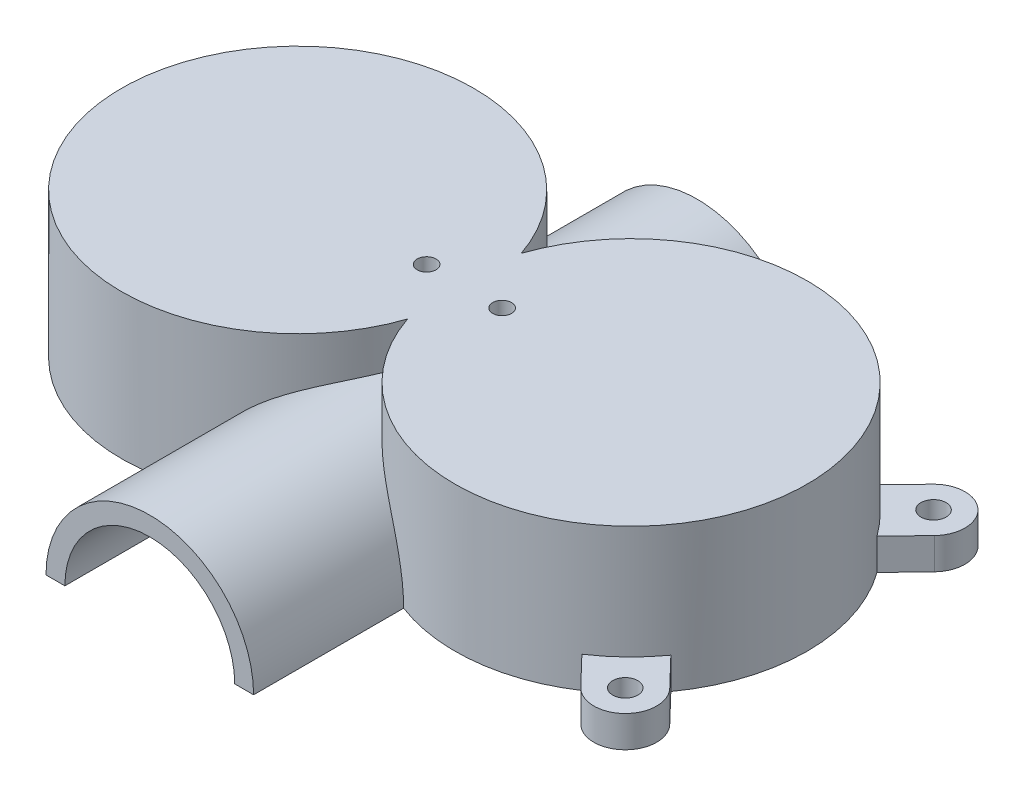
from build123d import *

# Parameters (mm, degrees)
BOSS_EXTRUDE1_DEPTH     = 23
SKETCH2_R               = 2
BOSS_EXTRUDE2_DEPTH     = 5
SKETCH3_R               = 2
BOSS_EXTRUDE3_DEPTH     = 5
BOSS_EXTRUDE4_DEPTH     = 37
BOSS_EXTRUDE5_START     = 50
BOSS_EXTRUDE5_DEPTH     = 50
CUT_EXTRUDE1_DEPTH      = 78.86002886
CUT_EXTRUDE1_DEPTH_BACK = 78.86002886
SKETCH5_R               = 25
CUT_EXTRUDE4_DEPTH      = 20
SKETCH7_R               = 1.5
CUT_EXTRUDE6_DEPTH      = 78.86002886


with BuildPart() as part:
    # Sketch1 → Boss-Extrude1 (new body)
    with BuildSketch(Plane(origin=(0, 0, 0), x_dir=(1, 0, 0), z_dir=(0, 1, 0))):
        with BuildLine():
            ThreePointArc((0, 9.04157066), (-54.5, 0), (0, -9.04157066))
            ThreePointArc((0, -9.04157066), (54.5, 0), (0, 9.04157066))
        make_face()
    extrude(amount=BOSS_EXTRUDE1_DEPTH)

    # Sketch2 → Boss-Extrude2 (add)
    with BuildSketch(Plane(origin=(0, 0, 0), x_dir=(1, 0, 0), z_dir=(0, 1, 0))):
        with BuildLine():
            Line((-33.5, 33), (-33.5, 27.110883423))
            ThreePointArc((-33.5, 27.110883423), (-28.532848636, 27.926108329), (-23.5, 27.838821814))
            Line((-23.5, 27.838821814), (-23.5, 33))
            ThreePointArc((-23.5, 33), (-28.5, 38), (-33.5, 33))
        make_face()
        with Locations((-28.5, 33)):
            Circle(SKETCH2_R, mode=Mode.SUBTRACT)
    extrude(amount=BOSS_EXTRUDE2_DEPTH)

    # Sketch3 → Boss-Extrude3 (add)
    # profile 1 of 2: a face of its own
    with BuildSketch(Plane(origin=(0, 0, 0), x_dir=(1, 0, 0), z_dir=(0, 1, 0))):
        with BuildLine():
            Line((41.999184876, -23.318989433), (46.471409292, -27.966816245))
            ThreePointArc((46.471409292, -27.966816245), (53.541166714, -28.102941176), (53.677291645, -21.033183755))
            Line((53.677291645, -21.033183755), (49.205067229, -16.385356942))
            ThreePointArc((49.205067229, -16.385356942), (45.914170974, -20.176470588), (41.999184876, -23.318989433))
        make_face()
        with Locations((50.074350468, -24.5)):
            Circle(SKETCH3_R, mode=Mode.SUBTRACT)
    # profile 2 of 2: a face of its own
    with BuildSketch(Plane(origin=(0, 0, 0), x_dir=(1, 0, 0), z_dir=(0, 1, 0))):
        with BuildLine():
            ThreePointArc((53.677291645, 21.033183755), (53.541166714, 28.102941176), (46.471409292, 27.966816245))
            Line((46.471409292, 27.966816245), (41.999184876, 23.318989433))
            ThreePointArc((41.999184876, 23.318989433), (45.914170974, 20.176470588), (49.205067229, 16.385356942))
            Line((49.205067229, 16.385356942), (53.677291645, 21.033183755))
        make_face()
        with Locations((50.074350468, 24.5)):
            Circle(SKETCH3_R, mode=Mode.SUBTRACT)
    extrude(amount=BOSS_EXTRUDE3_DEPTH)

    # Sketch6 → Boss-Extrude4 (add)
    with BuildSketch(Plane.XY):
        with BuildLine():
            Line((-16.5, 0), (16.5, 0))
            ThreePointArc((16.5, 0), (0, 16.5), (-16.5, 0))
        make_face()
    extrude(amount=-BOSS_EXTRUDE4_DEPTH)

    # Sketch6<2> → Boss-Extrude5 (add)
    with BuildSketch(Plane.XY.offset(BOSS_EXTRUDE5_START)):
        with BuildLine():
            Line((-16.5, 0), (16.5, 0))
            ThreePointArc((16.5, 0), (0, 16.5), (-16.5, 0))
        make_face()
    extrude(amount=-BOSS_EXTRUDE5_DEPTH)

    # Sketch4 → Cut-Extrude1 (cut, two sides: drawn at the far end of the back side and taken through both)
    with BuildSketch(Plane.XY.offset(-CUT_EXTRUDE1_DEPTH_BACK)):
        with BuildLine():
            Line((-13.5, 0), (13.5, 0))
            ThreePointArc((13.5, 0), (0, 13.5), (-13.5, 0))
        make_face()
    extrude(amount=CUT_EXTRUDE1_DEPTH + CUT_EXTRUDE1_DEPTH_BACK, mode=Mode.SUBTRACT)

    # Sketch5 → Cut-Extrude4 (cut)
    with BuildSketch(Plane(origin=(0, 0, 0), x_dir=(1, 0, 0), z_dir=(0, 1, 0))):
        with Locations((-26.5, 0)):
            Circle(SKETCH5_R)
        with Locations((26.5, 0)):
            Circle(SKETCH5_R)
    extrude(amount=CUT_EXTRUDE4_DEPTH, mode=Mode.SUBTRACT)

    # Sketch7 → Cut-Extrude6 (cut, through all)
    with BuildSketch(Plane(origin=(0, 0, 0), x_dir=(1, 0, 0), z_dir=(0, 1, 0))):
        with Locations((-6, 0)):
            Circle(SKETCH7_R)
        with Locations((6, 0)):
            Circle(SKETCH7_R)
    extrude(amount=CUT_EXTRUDE6_DEPTH, mode=Mode.SUBTRACT)


solid = part.part
